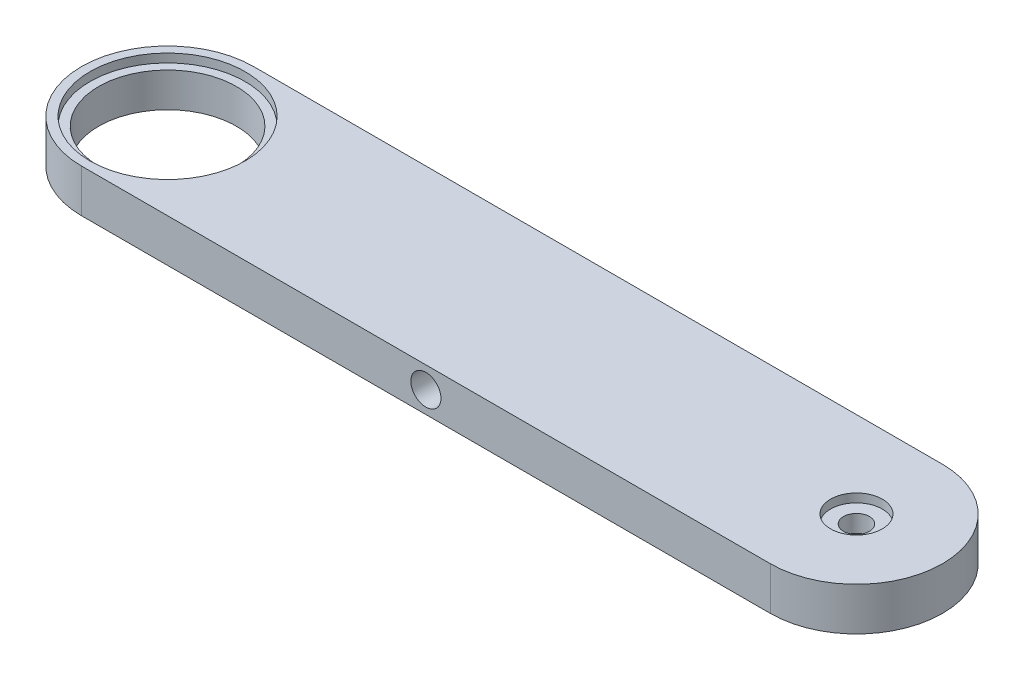
from build123d import *

# Parameters (mm, degrees)
BOSS_EXTRUDE1_DEPTH = 5
CUT_EXTRUDE1_DEPTH  = 52.23475383
SKETCH3_R           = 9
CUT_EXTRUDE2_DEPTH  = 1
SKETCH4_R           = 3
CUT_EXTRUDE3_DEPTH  = 1
SKETCH5_R           = 1.5
CUT_EXTRUDE4_DEPTH  = 52.14684741
SKETCH6_R           = 4
CUT_EXTRUDE5_DEPTH  = 2
SKETCH8_R           = 1.75
CUT_EXTRUDE7_DEPTH  = 10


with BuildPart() as part:
    # Sketch1 → Boss-Extrude1 (new body)
    with BuildSketch(Plane(origin=(0, 0, 0), x_dir=(1, 0, 0), z_dir=(0, 1, 0))):
        with BuildLine():
            Line((-40, 10), (40, 10))
            ThreePointArc((40, 10), (50, 0), (40, -10))
            Line((40, -10), (-40, -10))
            ThreePointArc((-40, -10), (-50, 0), (-40, 10))
        make_face()
    extrude(amount=BOSS_EXTRUDE1_DEPTH)

    # Sketch2 → Cut-Extrude1 (cut, through all)
    with BuildSketch(Plane(origin=(0, 5, 0), x_dir=(1, 0, 0), z_dir=(0, 1, 0))):
        with BuildLine():
            ThreePointArc((-32, 0), (-34.343145751, 5.656854249), (-40, 8))
            Line((-40, 8), (-40, -8))
            ThreePointArc((-40, -8), (-34.343145751, -5.656854249), (-32, 0))
        make_face()
        with BuildLine():
            Line((-40, -8), (-40, 8))
            ThreePointArc((-40, 8), (-48, 0), (-40, -8))
        make_face()
    extrude(amount=-CUT_EXTRUDE1_DEPTH, mode=Mode.SUBTRACT)

    # Sketch3 → Cut-Extrude2 (cut)
    with BuildSketch(Plane(origin=(0, 5, 0), x_dir=(1, 0, 0), z_dir=(0, 1, 0))):
        with Locations(Location((-40, 0, 0), (0, 0, 270))):
            Circle(SKETCH3_R)
    extrude(amount=-CUT_EXTRUDE2_DEPTH, mode=Mode.SUBTRACT)

    # Sketch4 → Cut-Extrude3 (cut)
    with BuildSketch(Plane(origin=(0, 5, 0), x_dir=(1, 0, 0), z_dir=(0, 1, 0))):
        with Locations(Location((40, 0, 0), (0, 0, 270))):
            Circle(SKETCH4_R)
    extrude(amount=-CUT_EXTRUDE3_DEPTH, mode=Mode.SUBTRACT)

    # Sketch5 → Cut-Extrude4 (cut, through all)
    with BuildSketch(Plane(origin=(0, 4, 0), x_dir=(1, 0, 0), z_dir=(0, 1, 0))):
        with Locations(Location((40, 0, 0), (0, 0, 270))):
            Circle(SKETCH5_R)
    extrude(amount=-CUT_EXTRUDE4_DEPTH, mode=Mode.SUBTRACT)

    # Sketch6 → Cut-Extrude5 (cut)
    with BuildSketch(Plane.XZ):
        with Locations(Location((40, 0, 0), (0, 0, 270))):
            Circle(SKETCH6_R)
    extrude(amount=-CUT_EXTRUDE5_DEPTH, mode=Mode.SUBTRACT)

    # Sketch8 → Cut-Extrude7 (cut)
    with BuildSketch(Plane.XY.offset(10)):
        with Locations((0, 2.5)):
            Circle(SKETCH8_R)
    extrude(amount=-CUT_EXTRUDE7_DEPTH, mode=Mode.SUBTRACT)


solid = part.part
